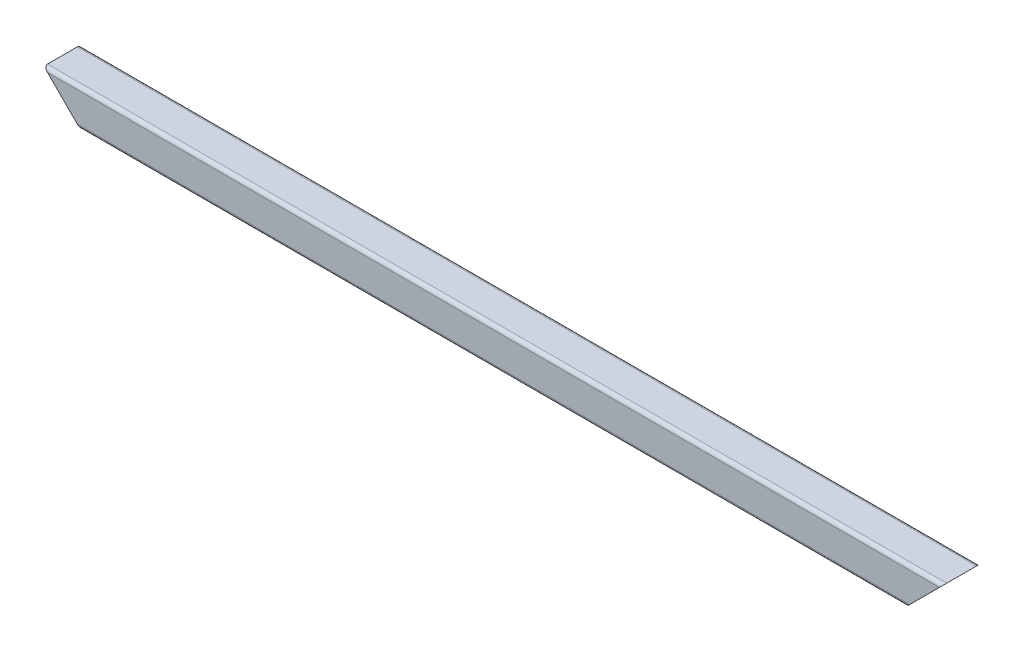
from build123d import *

# Parameters (mm, degrees)
SKETCH3_W           = 25.4
SKETCH3_H           = 25.4
SKETCH3_W_2         = 19.304
SKETCH3_H_2         = 19.304
BOSS_EXTRUDE1_DEPTH = 616.49
FILLET1_R           = 2.5
FILLET2_R           = 1
CUT_EXTRUDE1_DEPTH  = 618.143719161


with BuildPart() as part:
    # Sketch3 → Boss-Extrude1 (new body)
    with BuildSketch(Plane(origin=(0, 0, 0), x_dir=(0, 0, -1), z_dir=(1, 0, 0))):
        Rectangle(SKETCH3_W, SKETCH3_H)
        Rectangle(SKETCH3_W_2, SKETCH3_H_2, mode=Mode.SUBTRACT)
    extrude(amount=-BOSS_EXTRUDE1_DEPTH)

    # Fillet1
    fillet1_edges = [part.edges().sort_by_distance(p)[0] for p in [
        (-308.245, -12.7, -12.7),
        (-308.245, -12.7, 12.7),
        (-308.245, 12.7, 12.7),
        (-308.245, 12.7, -12.7),
    ]]
    fillet(fillet1_edges, radius=FILLET1_R)

    # Fillet2
    fillet2_edges = [part.edges().sort_by_distance(p)[0] for p in [
        (-308.245, 9.652, -9.652),
        (-308.245, -9.652, -9.652),
        (-308.245, -9.652, 9.652),
        (-308.245, 9.652, 9.652),
    ]]
    fillet(fillet2_edges, radius=FILLET2_R)

    # Sketch4 → Cut-Extrude1 (cut, through all)
    with BuildSketch(Plane.XY.offset(12.7)):
        Polygon((-616.49, 12.7), (-591.09, -12.7), (-616.49, -12.7), align=None)
        Polygon((0, 12.7), (-25.4, -12.7), (0, -12.7), align=None)
    extrude(amount=-CUT_EXTRUDE1_DEPTH, mode=Mode.SUBTRACT)


solid = part.part
